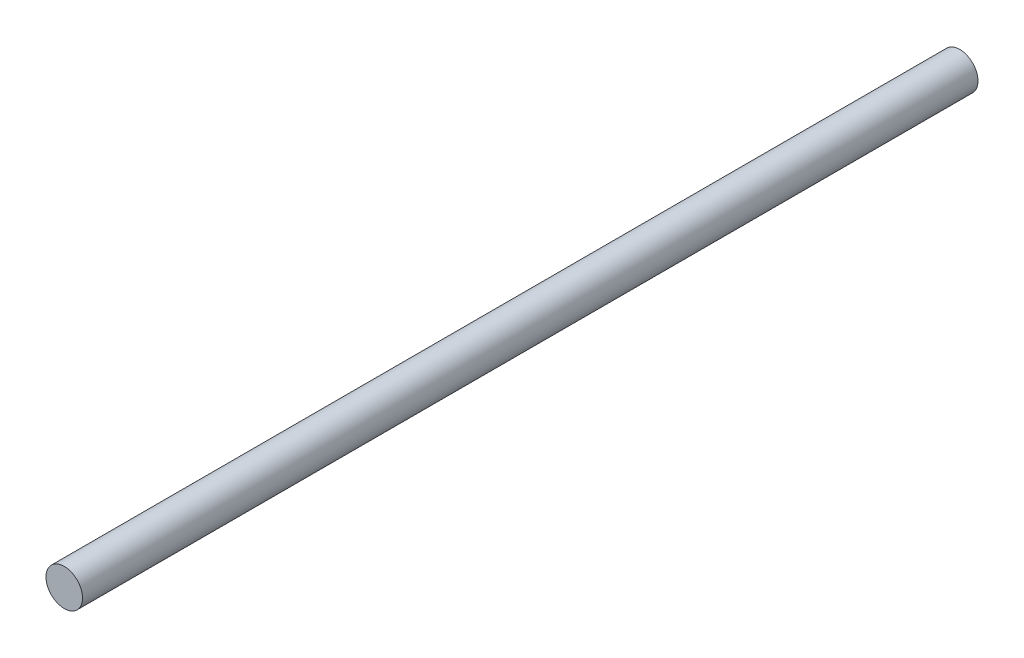
from build123d import *

# Parameters (mm, degrees)
ESQUISSE1_R        = 1
BOSS_EXTRU_1_DEPTH = 49


with BuildPart() as part:
    # Esquisse1 → Boss.-Extru.1 (new body)
    with BuildSketch(Plane.XY):
        Circle(ESQUISSE1_R)
    extrude(amount=BOSS_EXTRU_1_DEPTH)


solid = part.part
